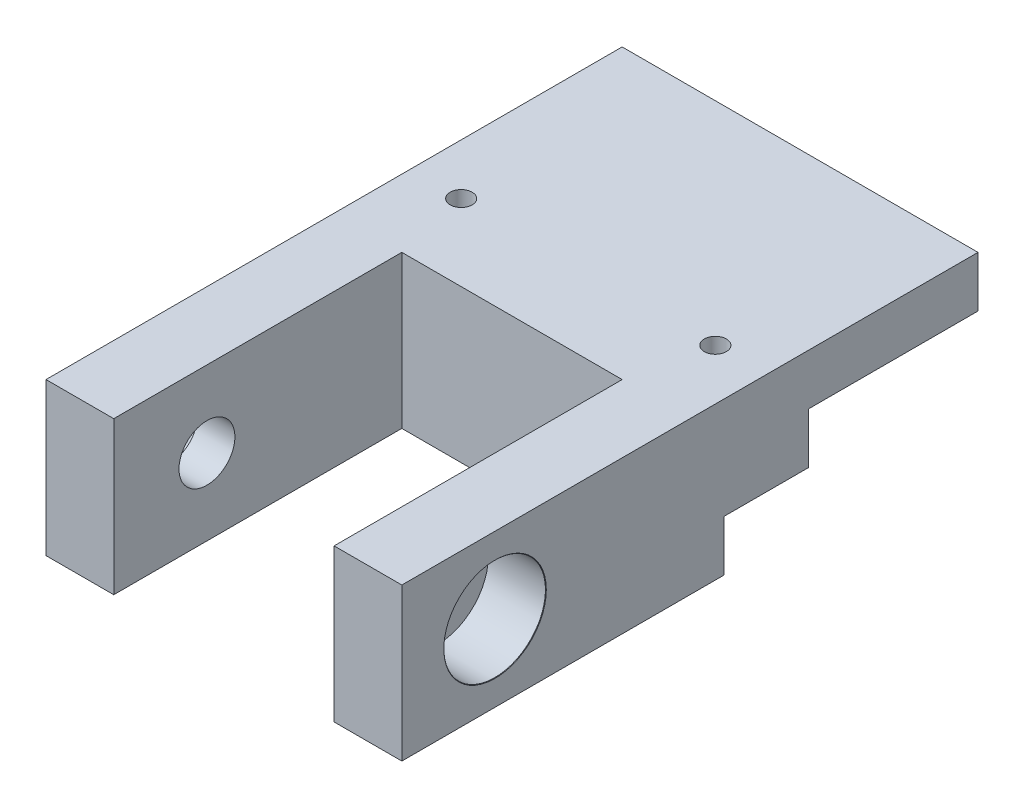
from build123d import *

# Parameters (mm, degrees)
SKETCH_1_W          = 21
SKETCH_1_H          = 34
EXTRUDE_1_DEPTH     = 9
SKETCH_4_W          = 21
SKETCH_4_H          = 10
CUT_EXTRUDE_1_DEPTH = 6
SKETCH_5_W          = 21
SKETCH_5_H          = 15
CUT_EXTRUDE_2_DEPTH = 3
SKETCH_6_W          = 13.003696042
SKETCH_6_H          = 17
CUT_EXTRUDE_3_DEPTH = 22.914607001
CUT_EXTRUDE_4_DEPTH = 1.8
CUT_EXTRUDE_5_REACH = 29.178
SKETCH_11_R         = 1.65
HOLE_WIZARD_1_D     = 1.3


with BuildPart() as part:
    # 草图1 → 凸台-拉伸1 (new body)
    with BuildSketch(Plane(origin=(0, 0, 0), x_dir=(1, 0, 0), z_dir=(0, 1, 0))):
        Rectangle(SKETCH_1_W, SKETCH_1_H)
    extrude(amount=EXTRUDE_1_DEPTH)

    # 草图4 → 切除-拉伸1 (cut)
    with BuildSketch(Plane.XZ):
        with Locations((0, -12)):
            Rectangle(SKETCH_4_W, SKETCH_4_H)
    extrude(amount=-CUT_EXTRUDE_1_DEPTH, mode=Mode.SUBTRACT)

    # 草图5 → 切除-拉伸2 (cut)
    with BuildSketch(Plane.XZ):
        with Locations((0, -9.5)):
            Rectangle(SKETCH_5_W, SKETCH_5_H)
    extrude(amount=-CUT_EXTRUDE_2_DEPTH, mode=Mode.SUBTRACT)

    # 草图6 → 切除-拉伸3 (cut, through all)
    with BuildSketch(Plane(origin=(0, 9, 0), x_dir=(1, 0, 0), z_dir=(0, 1, 0))):
        with Locations((0, -8.5)):
            Rectangle(SKETCH_6_W, SKETCH_6_H)
    extrude(amount=-CUT_EXTRUDE_3_DEPTH, mode=Mode.SUBTRACT)

    # 草图9 → M3 六角圆柱头螺钉的柱形沉头孔1 (revolve, cut)
    with BuildSketch(Plane(origin=(10.5, 4.5, 11.5), x_dir=(0, 0, -1), z_dir=(0, 1, 0))):
        Polygon((0, 0), (0, 3.998151979), (1.7, 3.998151979), (1.7, 3.4), (3, 3.4), (3, 0.025), (3.025, 0), align=None)
    revolve(axis=Axis((16.85, 4.5, 11.5), (-1, 0, 0)), mode=Mode.SUBTRACT)

    # 草图10 → 切除-拉伸4 (cut)
    with BuildSketch(Plane.ZY.offset(10.5)):
        Polygon((13.174315781, 1.6), (14.848631561, 4.5), (13.174315781, 7.4), (9.825684219, 7.4), (8.151368439, 4.5), (9.825684219, 1.6), align=None)
    extrude(amount=-CUT_EXTRUDE_4_DEPTH, mode=Mode.SUBTRACT)

    # 草图11 → 切除-拉伸5 (cut, up to next)
    with BuildSketch(Plane.ZY.offset(8.7), mode=Mode.PRIVATE) as cut_extrude_5_sk1:
        with Locations((11.5, 4.5)):
            Circle(SKETCH_11_R)
    cut_extrude_5_tool1 = extrude(cut_extrude_5_sk1.sketch, amount=-CUT_EXTRUDE_5_REACH, mode=Mode.PRIVATE) & part.part
    add(cut_extrude_5_tool1.solids().sort_by_distance((-8.7, 4.5, 11.5))[0], mode=Mode.SUBTRACT)

    # 孔1 (through all)
    with Locations(Plane(origin=(0, 9, 0), x_dir=(1, 0, 0), z_dir=(0, 1, 0))):
        with Locations((-7.5, 4.5), (7.5, 4.5)):
            Hole(HOLE_WIZARD_1_D / 2)


solid = part.part
